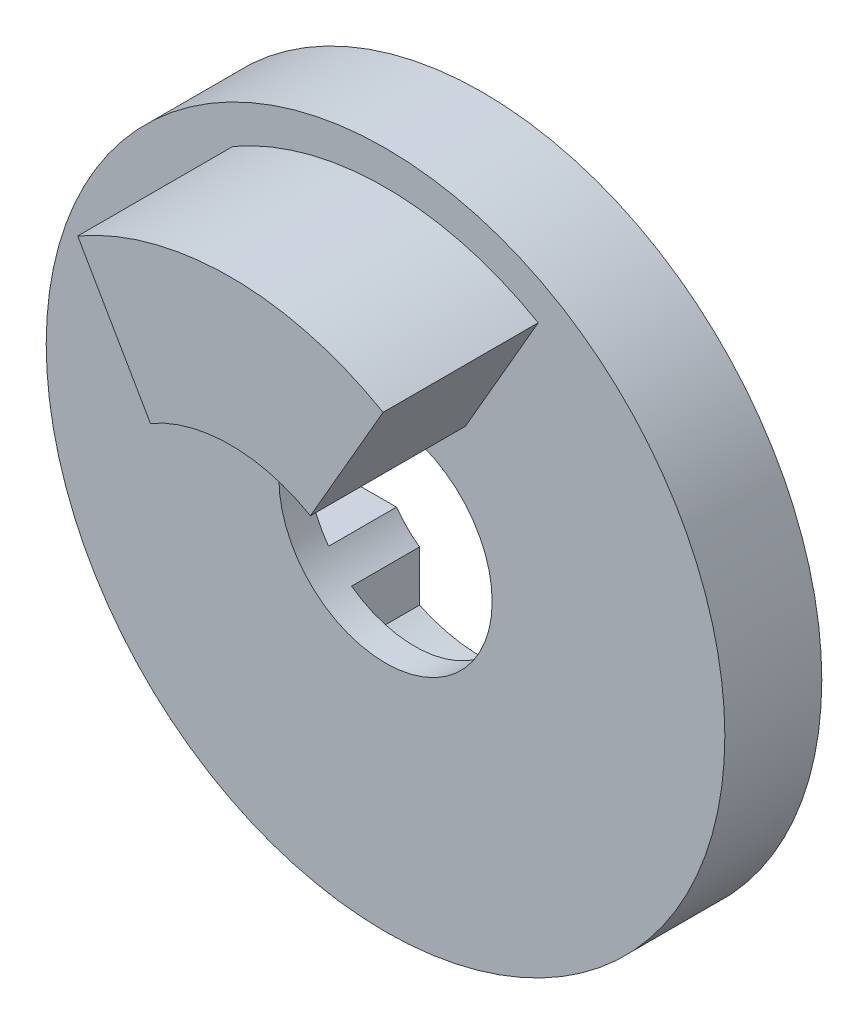
from build123d import *

# Parameters (mm, degrees)
SKETCH1_R               = 17.5
BOSS_EXTRUDE1_DEPTH     = 2.5
BOSS_EXTRUDE2_DEPTH     = 8
CUT_EXTRUDE1_DEPTH      = 27.009613607
CUT_EXTRUDE1_DEPTH_BACK = 27.009613607
SKETCH3_R               = 5.5
CUT_EXTRUDE4_START      = -3.5
CUT_EXTRUDE4_DEPTH      = 3.5
SKETCH5_R               = 13
SKETCH5_R_2             = 8
CUT_EXTRUDE5_DEPTH      = 2.2


with BuildPart() as part:
    # Sketch1 → Boss-Extrude1 (new, symmetric)
    with BuildSketch(Plane.XY):
        Circle(SKETCH1_R)
    extrude(amount=BOSS_EXTRUDE1_DEPTH, both=True)

    # Sketch2 → Boss-Extrude2 (add)
    with BuildSketch(Plane.XY.offset(2.5)):
        with BuildLine():
            Line((7.875, 13.63990011), (4.125, 7.144709581))
            ThreePointArc((4.125, 7.144709581), (0, 8.25), (-4.125, 7.144709581))
            Line((-4.125, 7.144709581), (-7.875, 13.63990011))
            ThreePointArc((-7.875, 13.63990011), (0, 15.75), (7.875, 13.63990011))
        make_face()
    extrude(amount=BOSS_EXTRUDE2_DEPTH)

    # Sketch3 → Cut-Extrude1 (cut, two sides: drawn at the far end of the back side and taken through both)
    with BuildSketch(Plane.XY.offset(2.5).offset(-CUT_EXTRUDE1_DEPTH_BACK)):
        Circle(SKETCH3_R)
    extrude(amount=CUT_EXTRUDE1_DEPTH + CUT_EXTRUDE1_DEPTH_BACK, mode=Mode.SUBTRACT)

    # Sketch4 → Cut-Extrude4 (cut)
    with BuildSketch(Plane(origin=(0, 0, -2.5), x_dir=(-1, 0, 0), z_dir=(0, 0, -1)).offset(CUT_EXTRUDE4_START)):
        with BuildLine():
            Line((-3.25, 7.03562364), (-3.25, 4.437059837))
            ThreePointArc((-3.25, 4.437059837), (0, 5.5), (3.25, 4.437059837))
            Line((3.25, 4.437059837), (3.25, 7.03562364))
            ThreePointArc((3.25, 7.03562364), (0, 7.75), (-3.25, 7.03562364))
        make_face()
        with BuildLine():
            Line((3.25, -4.437059837), (3.25, -7.03562364))
            ThreePointArc((3.25, -7.03562364), (0, -7.75), (-3.25, -7.03562364))
            Line((-3.25, -7.03562364), (-3.25, -4.437059837))
            ThreePointArc((-3.25, -4.437059837), (0, -5.5), (3.25, -4.437059837))
        make_face()
        with BuildLine():
            Line((-4.437059837, 3.25), (-7.03562364, 3.25))
            ThreePointArc((-7.03562364, 3.25), (-7.75, 0), (-7.03562364, -3.25))
            Line((-7.03562364, -3.25), (-4.437059837, -3.25))
            ThreePointArc((-4.437059837, -3.25), (-5.5, 0), (-4.437059837, 3.25))
        make_face()
        with BuildLine():
            Line((7.03562364, -3.25), (4.437059837, -3.25))
            ThreePointArc((4.437059837, -3.25), (5.5, 0), (4.437059837, 3.25))
            Line((4.437059837, 3.25), (7.03562364, 3.25))
            ThreePointArc((7.03562364, 3.25), (7.75, 0), (7.03562364, -3.25))
        make_face()
    extrude(amount=CUT_EXTRUDE4_DEPTH, mode=Mode.SUBTRACT)

    # Sketch5 → Cut-Extrude5 (cut)
    with BuildSketch(Plane(origin=(0, 0, -2.5), x_dir=(-1, 0, 0), z_dir=(0, 0, -1))):
        Circle(SKETCH5_R)
        Circle(SKETCH5_R_2, mode=Mode.SUBTRACT)
    extrude(amount=-CUT_EXTRUDE5_DEPTH, mode=Mode.SUBTRACT)


solid = part.part
